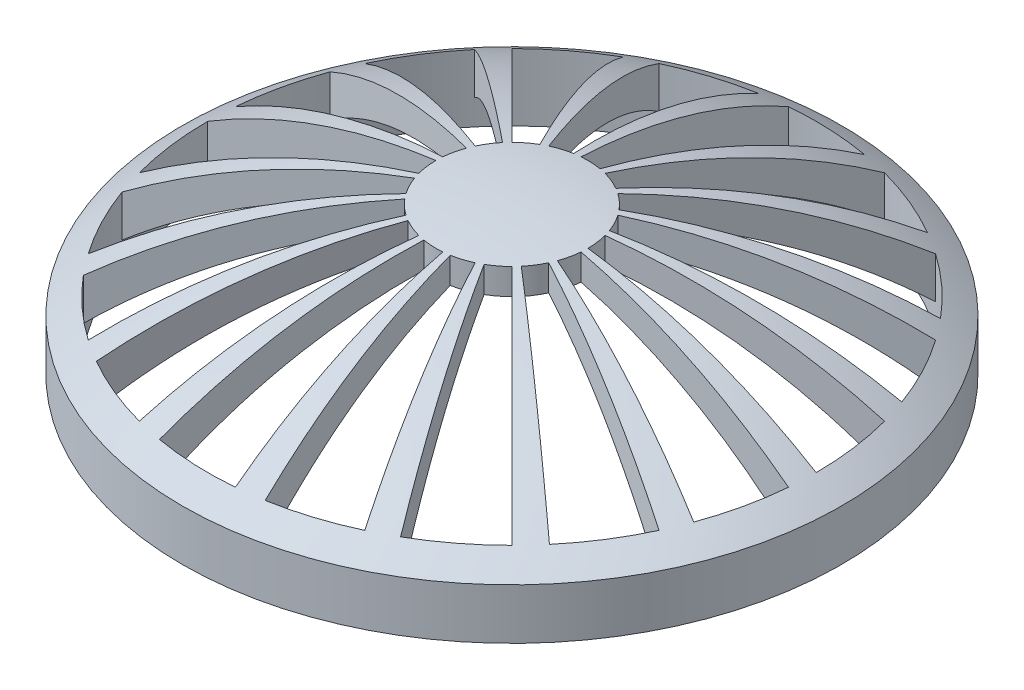
from build123d import *
from build123d.topology import SkipClean

# Parameters (mm, degrees)
SKETCH1_R           = 32.5
BOSS_EXTRUDE1_DEPTH = 5
DOME1_FACE_RADIUS   = 32.5
DOME1_HEIGHT        = 10
SKETCH2_R           = 30
CUT_EXTRUDE1_DEPTH  = 2.5
DOME6_FACE_RADIUS   = 30
DOME6_HEIGHT        = 10
CUT_EXTRUDE3_DEPTH  = 49.347699015


with BuildPart() as part:
    # Sketch1 → Boss-Extrude1 (new body)
    with BuildSketch(Plane(origin=(0, 0, 0), x_dir=(1, 0, 0), z_dir=(0, 1, 0))):
        with Locations(Location((0, 0, 0), (0, 0, 270))):
            Circle(SKETCH1_R)
    extrude(amount=BOSS_EXTRUDE1_DEPTH)

    # Dome1: a dome of height H over a round flat face of radius A is a cap of a sphere of radius (A * A + H * H) / (2 * H)
    dome1_r = (DOME1_FACE_RADIUS * DOME1_FACE_RADIUS + DOME1_HEIGHT * DOME1_HEIGHT) / (2 * DOME1_HEIGHT)
    dome1_base = Plane((0, 5, 0), z_dir=(0, 1, 0))
    with Locations(dome1_base.offset(DOME1_HEIGHT - dome1_r)):
        dome1_ball = Sphere(dome1_r, mode=Mode.PRIVATE)
    add(split(dome1_ball, bisect_by=dome1_base, keep=Keep.TOP, mode=Mode.PRIVATE))

    # Sketch2 → Cut-Extrude1 (cut)
    with BuildSketch(Plane(origin=(0, 0, 0), x_dir=(-1, 0, 0), z_dir=(0, -1, 0))):
        with Locations(Location((0, 0, 0), (0, 0, 90))):
            Circle(SKETCH2_R)
    extrude(amount=-CUT_EXTRUDE1_DEPTH, mode=Mode.SUBTRACT)

    # Dome6: a dome of height H over a round flat face of radius A is a cap of a sphere of radius (A * A + H * H) / (2 * H)
    dome6_r = (DOME6_FACE_RADIUS * DOME6_FACE_RADIUS + DOME6_HEIGHT * DOME6_HEIGHT) / (2 * DOME6_HEIGHT)
    dome6_base = Plane((0, 2.5, 0), z_dir=(0, 1, 0))
    with Locations(dome6_base.offset(DOME6_HEIGHT - dome6_r)):
        dome6_ball = Sphere(dome6_r, mode=Mode.PRIVATE)
    add(split(dome6_ball, bisect_by=dome6_base, keep=Keep.TOP, mode=Mode.PRIVATE), mode=Mode.SUBTRACT)

    # Sketch4 → Cut-Extrude3 (cut, through all)
    with SkipClean():  # the faces are left unmerged after this step: merging them gives an invalid solid
        with BuildSketch(Plane.XZ):
            with BuildLine():
                Line((-7.5, 0), (-30, 0))
                ThreePointArc((-30, 0), (-29.743345841, 3.915785767), (-28.977774789, 7.764571353))
                Line((-28.977774789, 7.764571353), (-7.244443697, 1.941142838))
                ThreePointArc((-7.244443697, 1.941142838), (-7.43583646, 0.978946442), (-7.5, 0))
            make_face()
            with BuildLine():
                Line((-7.047694656, 2.565151075), (-28.190778624, 10.2606043))
                ThreePointArc((-28.190778624, 10.2606043), (-26.610324995, 13.852458397), (-24.574561329, 17.207293091))
                Line((-24.574561329, 17.207293091), (-6.143640332, 4.301823273))
                ThreePointArc((-6.143640332, 4.301823273), (-6.652581249, 3.463114599), (-7.047694656, 2.565151075))
            make_face()
            with BuildLine():
                Line((-5.745333323, 4.820907073), (-22.981333294, 19.283628291))
                ThreePointArc((-22.981333294, 19.283628291), (-20.267706228, 22.118320104), (-17.207293091, 24.574561329))
                Line((-17.207293091, 24.574561329), (-4.301823273, 6.143640332))
                ThreePointArc((-4.301823273, 6.143640332), (-5.066926557, 5.529580026), (-5.745333323, 4.820907073))
            make_face()
            with BuildLine():
                Line((-3.75, 6.495190528), (-15, 25.980762114))
                ThreePointArc((-15, 25.980762114), (-11.480502971, 27.716385975), (-7.764571353, 28.977774789))
                Line((-7.764571353, 28.977774789), (-1.941142838, 7.244443697))
                ThreePointArc((-1.941142838, 7.244443697), (-2.870125743, 6.929096494), (-3.75, 6.495190528))
            make_face()
            with BuildLine():
                Line((-1.302361333, 7.386058148), (-5.20944533, 29.54423259))
                ThreePointArc((-5.20944533, 29.54423259), (-1.308581621, 29.971446647), (2.614672282, 29.885840943))
                Line((2.614672282, 29.885840943), (0.653668071, 7.471460236))
                ThreePointArc((0.653668071, 7.471460236), (-0.327145405, 7.492861662), (-1.302361333, 7.386058148))
            make_face()
            with BuildLine():
                Line((1.302361333, 7.386058148), (5.20944533, 29.54423259))
                ThreePointArc((5.20944533, 29.54423259), (9.021173985, 28.611508522), (12.678547852, 27.189233611))
                Line((12.678547852, 27.189233611), (3.169636963, 6.797308403))
                ThreePointArc((3.169636963, 6.797308403), (2.255293496, 7.152877131), (1.302361333, 7.386058148))
            make_face()
            with BuildLine():
                Line((3.75, 6.495190528), (15, 25.980762114))
                ThreePointArc((15, 25.980762114), (18.26284287, 23.800600209), (21.213203436, 21.213203436))
                Line((21.213203436, 21.213203436), (5.303300859, 5.303300859))
                ThreePointArc((5.303300859, 5.303300859), (4.565710718, 5.950150052), (3.75, 6.495190528))
            make_face()
            with BuildLine():
                Line((5.745333323, 4.820907073), (22.981333294, 19.283628291))
                ThreePointArc((22.981333294, 19.283628291), (25.301743374, 16.11898825), (27.189233611, 12.678547852))
                Line((27.189233611, 12.678547852), (6.797308403, 3.169636963))
                ThreePointArc((6.797308403, 3.169636963), (6.325435844, 4.029747063), (5.745333323, 4.820907073))
            make_face()
            with BuildLine():
                Line((7.047694656, 2.565151075), (28.190778624, 10.2606043))
                ThreePointArc((28.190778624, 10.2606043), (29.288880214, 6.493188418), (29.885840943, 2.614672282))
                Line((29.885840943, 2.614672282), (7.471460236, 0.653668071))
                ThreePointArc((7.471460236, 0.653668071), (7.322220053, 1.623297105), (7.047694656, 2.565151075))
            make_face()
            with BuildLine():
                Line((7.5, 0), (30, 0))
                ThreePointArc((30, 0), (29.743345841, -3.915785767), (28.977774789, -7.764571353))
                Line((28.977774789, -7.764571353), (7.244443697, -1.941142838))
                ThreePointArc((7.244443697, -1.941142838), (7.43583646, -0.978946442), (7.5, 0))
            make_face()
            with BuildLine():
                Line((7.047694656, -2.565151075), (28.190778624, -10.2606043))
                ThreePointArc((28.190778624, -10.2606043), (26.610324995, -13.852458397), (24.574561329, -17.207293091))
                Line((24.574561329, -17.207293091), (6.143640332, -4.301823273))
                ThreePointArc((6.143640332, -4.301823273), (6.652581249, -3.463114599), (7.047694656, -2.565151075))
            make_face()
            with BuildLine():
                Line((5.745333323, -4.820907073), (22.981333294, -19.283628291))
                ThreePointArc((22.981333294, -19.283628291), (20.267706228, -22.118320104), (17.207293091, -24.574561329))
                Line((17.207293091, -24.574561329), (4.301823273, -6.143640332))
                ThreePointArc((4.301823273, -6.143640332), (5.066926557, -5.529580026), (5.745333323, -4.820907073))
            make_face()
            with BuildLine():
                Line((3.75, -6.495190528), (15, -25.980762114))
                ThreePointArc((15, -25.980762114), (11.480502971, -27.716385975), (7.764571353, -28.977774789))
                Line((7.764571353, -28.977774789), (1.941142838, -7.244443697))
                ThreePointArc((1.941142838, -7.244443697), (2.870125743, -6.929096494), (3.75, -6.495190528))
            make_face()
            with BuildLine():
                Line((1.302361333, -7.386058148), (5.20944533, -29.54423259))
                ThreePointArc((5.20944533, -29.54423259), (1.308581621, -29.971446647), (-2.614672282, -29.885840943))
                Line((-2.614672282, -29.885840943), (-0.653668071, -7.471460236))
                ThreePointArc((-0.653668071, -7.471460236), (0.327145405, -7.492861662), (1.302361333, -7.386058148))
            make_face()
            with BuildLine():
                Line((-1.302361333, -7.386058148), (-5.20944533, -29.54423259))
                ThreePointArc((-5.20944533, -29.54423259), (-9.021173985, -28.611508522), (-12.678547852, -27.189233611))
                Line((-12.678547852, -27.189233611), (-3.169636963, -6.797308403))
                ThreePointArc((-3.169636963, -6.797308403), (-2.255293496, -7.152877131), (-1.302361333, -7.386058148))
            make_face()
            with BuildLine():
                Line((-3.75, -6.495190528), (-15, -25.980762114))
                ThreePointArc((-15, -25.980762114), (-18.26284287, -23.800600209), (-21.213203436, -21.213203436))
                Line((-21.213203436, -21.213203436), (-5.303300859, -5.303300859))
                ThreePointArc((-5.303300859, -5.303300859), (-4.565710718, -5.950150052), (-3.75, -6.495190528))
            make_face()
            with BuildLine():
                Line((-5.745333323, -4.820907073), (-22.981333294, -19.283628291))
                ThreePointArc((-22.981333294, -19.283628291), (-25.301743374, -16.11898825), (-27.189233611, -12.678547852))
                Line((-27.189233611, -12.678547852), (-6.797308403, -3.169636963))
                ThreePointArc((-6.797308403, -3.169636963), (-6.325435844, -4.029747063), (-5.745333323, -4.820907073))
            make_face()
            with BuildLine():
                Line((-7.047694656, -2.565151075), (-28.190778624, -10.2606043))
                ThreePointArc((-28.190778624, -10.2606043), (-29.288880214, -6.493188418), (-29.885840943, -2.614672282))
                Line((-29.885840943, -2.614672282), (-7.471460236, -0.653668071))
                ThreePointArc((-7.471460236, -0.653668071), (-7.322220053, -1.623297105), (-7.047694656, -2.565151075))
            make_face()
        extrude(amount=-CUT_EXTRUDE3_DEPTH, mode=Mode.SUBTRACT)


solid = part.part
